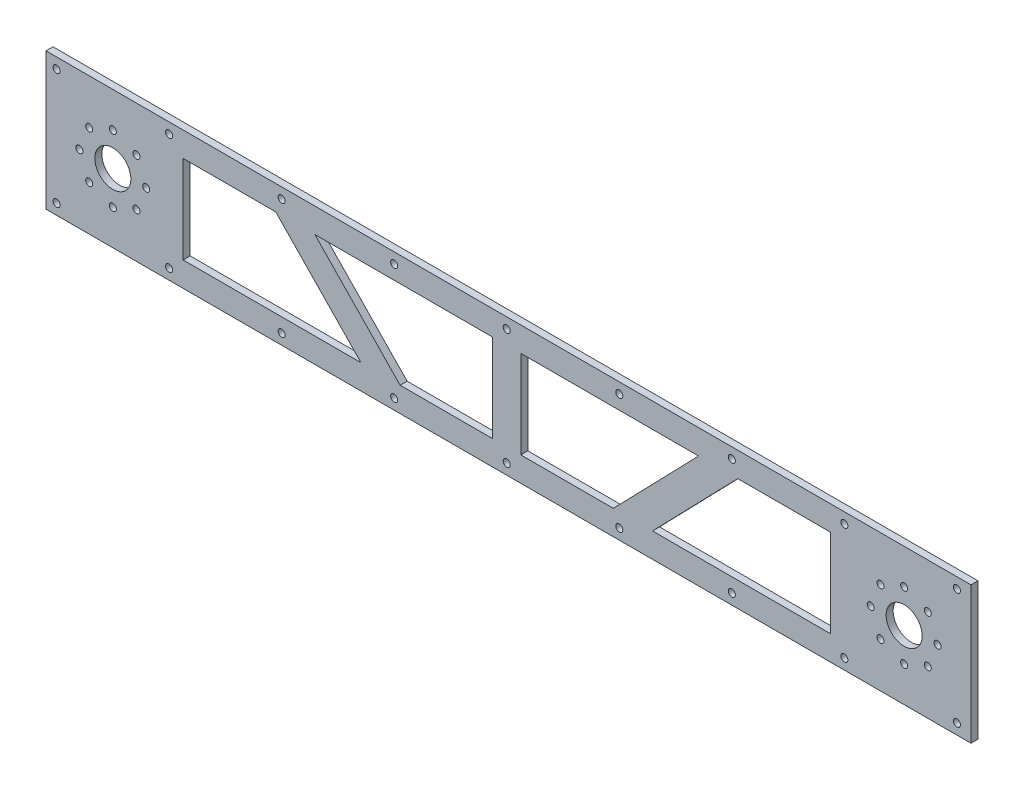
from build123d import *

# Parameters (mm, degrees)
SKETCH_1_W      = 526
SKETCH_1_H      = 78
SKETCH_1_R      = 2
SKETCH_1_R_2    = 10.25
EXTRUDE_1_DEPTH = 4


with BuildPart() as part:
    # 草图1 → 凸台-拉伸1 (new body)
    with BuildSketch(Plane.XY):
        with Locations((225, 0)):
            Rectangle(SKETCH_1_W, SKETCH_1_H)
        with Locations((-32, -33)):
            Circle(SKETCH_1_R, mode=Mode.SUBTRACT)
        with Locations((32, -33)):
            Circle(SKETCH_1_R, mode=Mode.SUBTRACT)
        with Locations((96, -33)):
            Circle(SKETCH_1_R, mode=Mode.SUBTRACT)
        with Locations((160, -33)):
            Circle(SKETCH_1_R, mode=Mode.SUBTRACT)
        with Locations((224, -33)):
            Circle(SKETCH_1_R, mode=Mode.SUBTRACT)
        with Locations((0, -19)):
            Circle(SKETCH_1_R, mode=Mode.SUBTRACT)
        with Locations((-13.435028843, -13.435028843)):
            Circle(SKETCH_1_R, mode=Mode.SUBTRACT)
        with Locations((13.435028843, -13.435028843)):
            Circle(SKETCH_1_R, mode=Mode.SUBTRACT)
        with Locations((19, 0)):
            Circle(SKETCH_1_R, mode=Mode.SUBTRACT)
        with Locations((288, -33)):
            Circle(SKETCH_1_R, mode=Mode.SUBTRACT)
        with Locations((352, -33)):
            Circle(SKETCH_1_R, mode=Mode.SUBTRACT)
        with Locations((416, -33)):
            Circle(SKETCH_1_R, mode=Mode.SUBTRACT)
        with Locations((480, -33)):
            Circle(SKETCH_1_R, mode=Mode.SUBTRACT)
        with Locations((450, -19)):
            Circle(SKETCH_1_R, mode=Mode.SUBTRACT)
        with Locations((436.564971157, -13.435028843)):
            Circle(SKETCH_1_R, mode=Mode.SUBTRACT)
        with Locations((463.435028843, -13.435028843)):
            Circle(SKETCH_1_R, mode=Mode.SUBTRACT)
        with Locations((-19, 0)):
            Circle(SKETCH_1_R, mode=Mode.SUBTRACT)
        Circle(SKETCH_1_R_2, mode=Mode.SUBTRACT)
        Polygon((40, -25), (40, 25), (92.613968548, 25), (141.098817033, -25), align=None, mode=Mode.SUBTRACT)
        with Locations((-13.435028843, 13.435028843)):
            Circle(SKETCH_1_R, mode=Mode.SUBTRACT)
        with Locations((13.435028843, 13.435028843)):
            Circle(SKETCH_1_R, mode=Mode.SUBTRACT)
        with Locations((0, 19)):
            Circle(SKETCH_1_R, mode=Mode.SUBTRACT)
        Polygon((163.386031452, -25), (114.901182967, 25), (216, 25), (216, -25), align=None, mode=Mode.SUBTRACT)
        with Locations((-32, 33)):
            Circle(SKETCH_1_R, mode=Mode.SUBTRACT)
        with Locations((32, 33)):
            Circle(SKETCH_1_R, mode=Mode.SUBTRACT)
        with Locations((96, 33)):
            Circle(SKETCH_1_R, mode=Mode.SUBTRACT)
        with Locations((160, 33)):
            Circle(SKETCH_1_R, mode=Mode.SUBTRACT)
        with Locations((224, 33)):
            Circle(SKETCH_1_R, mode=Mode.SUBTRACT)
        Polygon((333.098817033, 25), (284.613968548, -25), (232, -25), (232, 25), align=None, mode=Mode.SUBTRACT)
        Polygon((408, -25), (306.901182967, -25), (355.386031452, 25), (408, 25), align=None, mode=Mode.SUBTRACT)
        with Locations((431, 0)):
            Circle(SKETCH_1_R, mode=Mode.SUBTRACT)
        with Locations((450, 0)):
            Circle(SKETCH_1_R_2, mode=Mode.SUBTRACT)
        with Locations((469, 0)):
            Circle(SKETCH_1_R, mode=Mode.SUBTRACT)
        with Locations((436.564971157, 13.435028843)):
            Circle(SKETCH_1_R, mode=Mode.SUBTRACT)
        with Locations((463.435028843, 13.435028843)):
            Circle(SKETCH_1_R, mode=Mode.SUBTRACT)
        with Locations((450, 19)):
            Circle(SKETCH_1_R, mode=Mode.SUBTRACT)
        with Locations((288, 33)):
            Circle(SKETCH_1_R, mode=Mode.SUBTRACT)
        with Locations((352, 33)):
            Circle(SKETCH_1_R, mode=Mode.SUBTRACT)
        with Locations((416, 33)):
            Circle(SKETCH_1_R, mode=Mode.SUBTRACT)
        with Locations((480, 33)):
            Circle(SKETCH_1_R, mode=Mode.SUBTRACT)
    extrude(amount=EXTRUDE_1_DEPTH)


solid = part.part
